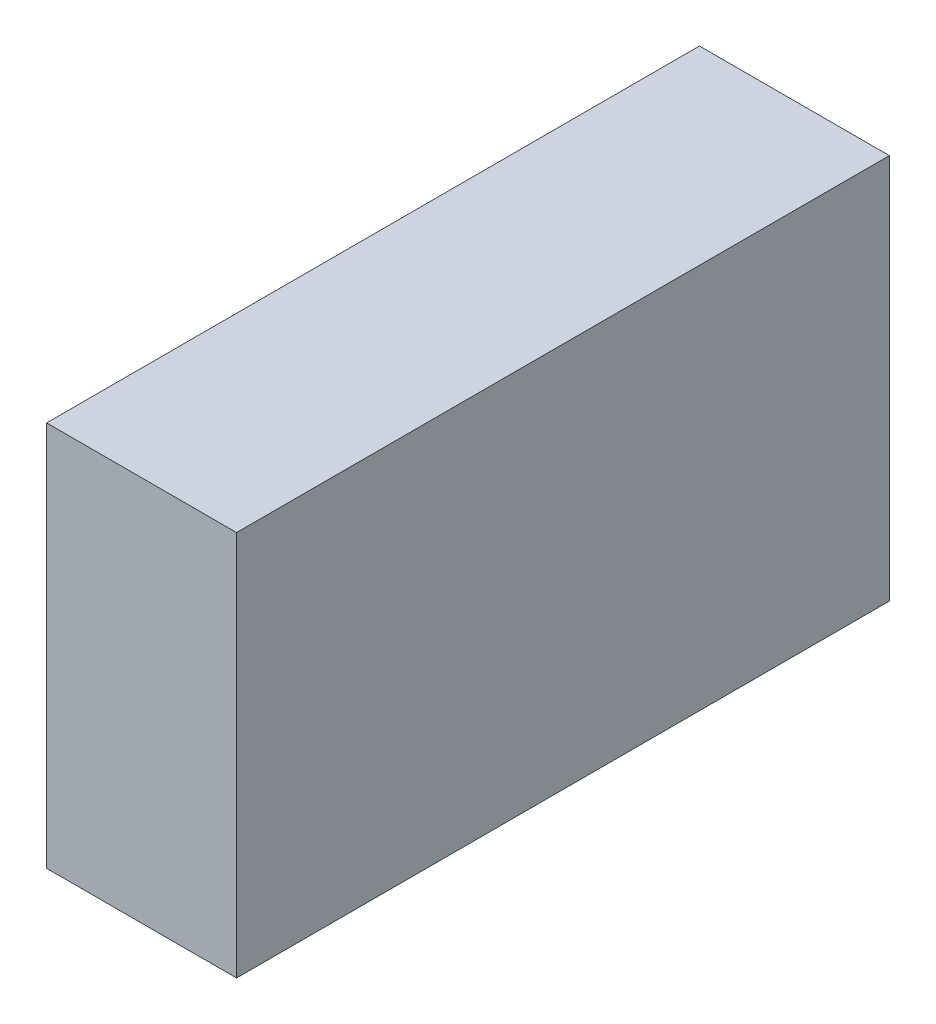
from build123d import *

# Parameters (mm, degrees)
SKETCH_1_W      = 32
SKETCH_1_H      = 65
EXTRUDE_1_DEPTH = 110


with BuildPart() as part:
    # 草圖1 → 填料-伸長1 (new body)
    with BuildSketch(Plane.XY):
        Rectangle(SKETCH_1_W, SKETCH_1_H)
    extrude(amount=EXTRUDE_1_DEPTH)


solid = part.part
